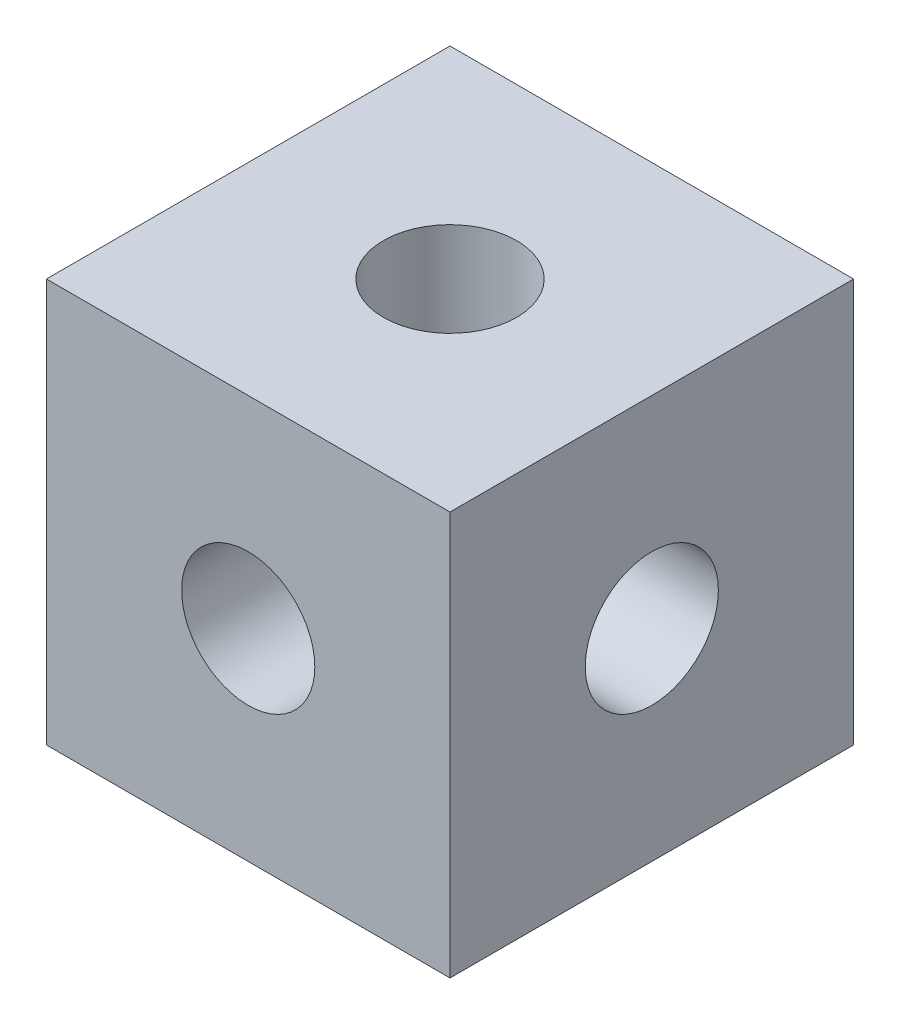
from build123d import *

# Parameters (mm, degrees)
SKETCH_1_W      = 10
SKETCH_1_H      = 10
EXTRUDE_1_DEPTH = 10
HOLE_WIZARD_1_D = 3.3
HOLE_WIZARD_2_D = 3.3
HOLE_WIZARD_3_D = 3.3


with BuildPart() as part:
    # 草图1 → 凸台-拉伸1 (new body)
    with BuildSketch(Plane(origin=(0, 0, 0), x_dir=(1, 0, 0), z_dir=(0, 1, 0))):
        Rectangle(SKETCH_1_W, SKETCH_1_H)
    extrude(amount=EXTRUDE_1_DEPTH)

    # 孔1 (through all)
    with Locations(Plane(origin=(0, 10, 0), x_dir=(1, 0, 0), z_dir=(0, 1, 0))):
        with Locations((0, 0)):
            Hole(HOLE_WIZARD_1_D / 2)

    # 孔2 (through all)
    with Locations(Plane(origin=(5, 0, 0), x_dir=(0, 0, -1), z_dir=(1, 0, 0))):
        with Locations((0, 5)):
            Hole(HOLE_WIZARD_2_D / 2)

    # 孔3 (through all)
    with Locations(Plane.XY.offset(5)):
        with Locations((0, 5)):
            Hole(HOLE_WIZARD_3_D / 2)


solid = part.part
